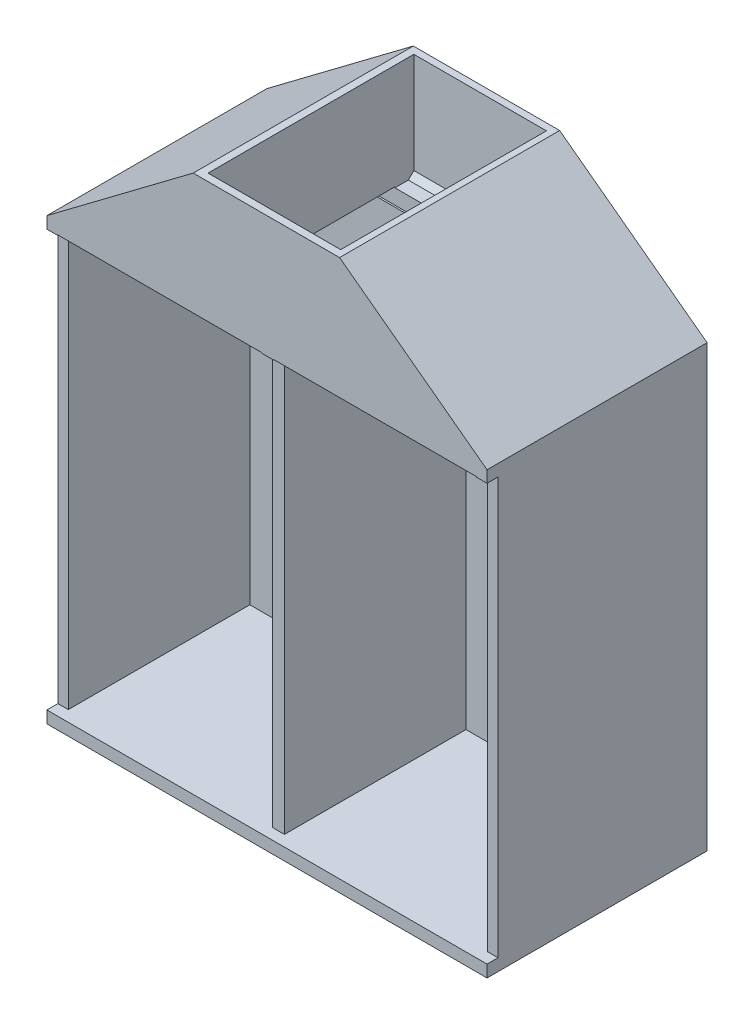
from build123d import *

# Parameters (mm, degrees)
SKETCH1_W           = 371.348752766
SKETCH1_H           = 757.75300928
SKETCH1_W_2         = 369.177102164
BOSS_EXTRUDE2_DEPTH = 400
SKETCH2_W           = 762.063158907
SKETCH2_H           = 50
BOSS_EXTRUDE3_DEPTH = 761
SKETCH3_W           = 800
SKETCH3_H           = 756.769192836
CUT_EXTRUDE1_DEPTH  = 20
SKETCH4_W           = 240.999510027
SKETCH4_H           = 373.99553593
CUT_EXTRUDE2_DEPTH  = 164
SKETCH5_W           = 366.749799027
SKETCH5_H           = 332.09627471
CUT_EXTRUDE4_DEPTH  = 29
SKETCH6_W           = 240.999510027
SKETCH6_H           = 373.99553593
CUT_EXTRUDE5_DEPTH  = 29
SKETCH7_W           = 372.210354375
SKETCH7_H           = 328.047679772
CUT_EXTRUDE7_DEPTH  = 29
CHAMFER2_SIZE       = 10


with BuildPart() as part:
    # Sketch1 → Boss-Extrude2 (new body)
    with BuildSketch(Plane.XY):
        Polygon((-56.757111626, 778.097101449), (-56.757111626, -21.902898551), (743.242888374, -21.902898551), (743.242888374, 778.097101449), (475.242888374, 978.097101449), (209.242888374, 978.097101449), align=None)
        with Locations((147.788525051, 378.87650464)):
            Rectangle(SKETCH1_W, SKETCH1_H, mode=Mode.SUBTRACT)
        with Locations((539.588756493, 378.87650464)):
            Rectangle(SKETCH1_W_2, SKETCH1_H, mode=Mode.SUBTRACT)
    extrude(amount=BOSS_EXTRUDE2_DEPTH)

    # Sketch2 → Boss-Extrude3 (add)
    with BuildSketch(Plane(origin=(0, 0, 0), x_dir=(1, 0, 0), z_dir=(0, 1, 0))):
        with Locations((343.145728122, -25)):
            Rectangle(SKETCH2_W, SKETCH2_H)
    extrude(amount=BOSS_EXTRUDE3_DEPTH)

    # Sketch3 → Cut-Extrude1 (cut)
    with BuildSketch(Plane.XY.offset(400)):
        with Locations((343.242888374, 378.384596418)):
            Rectangle(SKETCH3_W, SKETCH3_H)
    extrude(amount=-CUT_EXTRUDE1_DEPTH, mode=Mode.SUBTRACT)

    # Sketch4 → Cut-Extrude2 (cut)
    with BuildSketch(Plane(origin=(0, 978.097101449, 0), x_dir=(1, 0, 0), z_dir=(0, 1, 0))):
        with Locations((343.242888374, -199.553704611)):
            Rectangle(SKETCH4_W, SKETCH4_H)
    extrude(amount=-CUT_EXTRUDE2_DEPTH, mode=Mode.SUBTRACT)

    # Sketch5 → Cut-Extrude4 (cut)
    with BuildSketch(Plane.XZ.offset(-757.75300928)):
        with Locations((148.316814088, 212.995071619)):
            Rectangle(SKETCH5_W, SKETCH5_H)
    extrude(amount=-CUT_EXTRUDE4_DEPTH, mode=Mode.SUBTRACT)

    # Sketch6 → Cut-Extrude5 (cut)
    with BuildSketch(Plane(origin=(0, 814.097101449, 0), x_dir=(1, 0, 0), z_dir=(0, 1, 0))):
        with Locations((343.242888374, -199.553704611)):
            Rectangle(SKETCH6_W, SKETCH6_H)
    extrude(amount=-CUT_EXTRUDE5_DEPTH, mode=Mode.SUBTRACT)

    # Sketch7 → Cut-Extrude7 (cut)
    with BuildSketch(Plane.XZ.offset(-757.75300928)):
        with Locations((540.059154896, 214.239949558)):
            Rectangle(SKETCH7_W, SKETCH7_H)
    extrude(amount=-CUT_EXTRUDE7_DEPTH, mode=Mode.SUBTRACT)

    # Chamfer2
    chamfer2_edges = [part.edges().sort_by_distance(p)[0] for p in [
        (343.242888374, 785.097101449, 12.555936646),
        (331.691713601, 785.097101449, 212.995071619),
        (353.953977708, 785.097101449, 214.239949558),
    ]]
    chamfer(chamfer2_edges, length=CHAMFER2_SIZE)


solid = part.part
